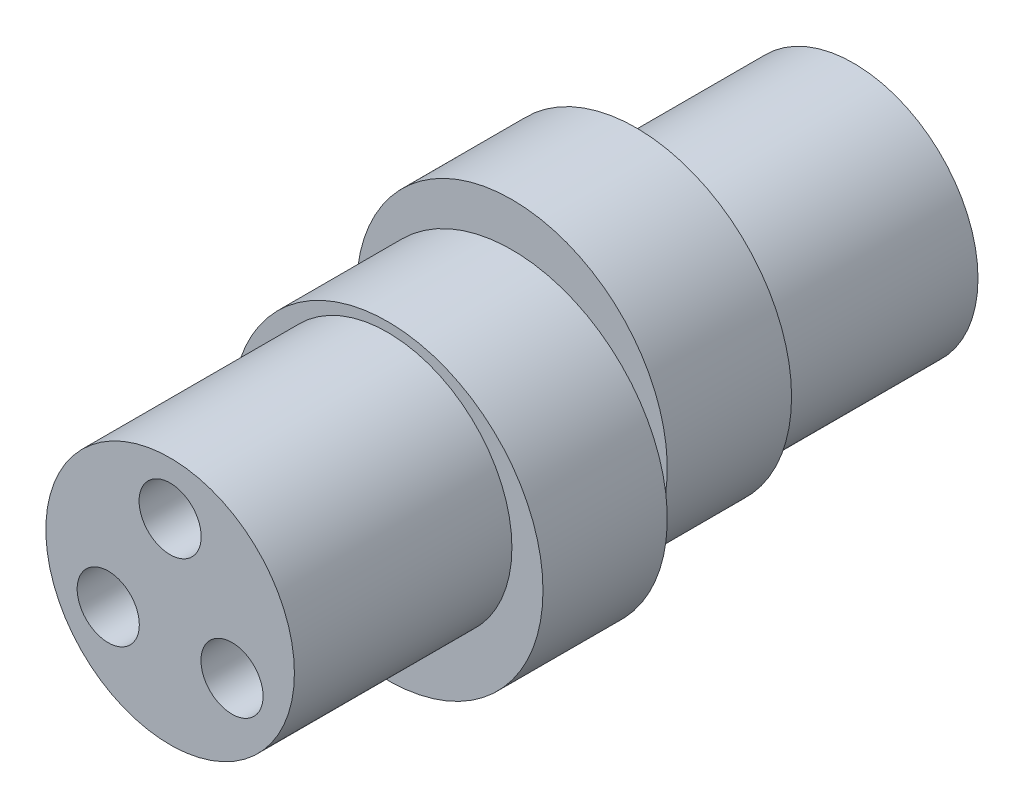
from build123d import *

# Parameters (mm, degrees)
SKETCH1_R                = 5
BOSS_EXTRUDE1_DEPTH      = 4
BOSS_EXTRUDE2_START      = 4
SKETCH2_R                = 5
BOSS_EXTRUDE2_DEPTH      = 4
BOSS_EXTRUDE5_DEPTH      = 15
BOSS_EXTRUDE5_DEPTH_BACK = 7
SKETCH5_R                = 4
CUT_EXTRUDE1_DEPTH       = 17.807438829
CUT_EXTRUDE1_DEPTH_BACK  = 17.807438829
SKETCH9_R                = 1


with BuildPart() as part:
    # Sketch1 → Boss-Extrude1 (new body)
    with BuildSketch(Plane.XY):
        with Locations((0, 0.7)):
            Circle(SKETCH1_R)
    extrude(amount=BOSS_EXTRUDE1_DEPTH)

    # Sketch2 → Boss-Extrude2 (add)
    with BuildSketch(Plane.XY.offset(BOSS_EXTRUDE2_START)):
        with Locations(Location((0, -0.7, 0), (0, 0, 171.952153753))):
            Circle(SKETCH2_R)
    extrude(amount=BOSS_EXTRUDE2_DEPTH)

    # Sketch5 → Boss-Extrude5 (add, two sides: drawn at the far end of the back side and taken through both)
    with BuildSketch(Plane.XY.offset(-BOSS_EXTRUDE5_DEPTH_BACK)):
        Circle(SKETCH5_R)
    extrude(amount=BOSS_EXTRUDE5_DEPTH + BOSS_EXTRUDE5_DEPTH_BACK)

    # Sketch9 → Cut-Extrude1 (cut, two sides: drawn at the far end of the back side and taken through both)
    with BuildSketch(Plane.XY.offset(-CUT_EXTRUDE1_DEPTH_BACK)):
        with BuildLine():
            ThreePointArc((0, 3.3), (-1, 2.3), (0, 1.3))
            Line((0, 1.3), (0, 3.3))
        make_face()
        with BuildLine():
            Line((0, 3.3), (0, 1.3))
            ThreePointArc((0, 1.3), (0.707106781, 1.592893219), (1, 2.3))
            ThreePointArc((1, 2.3), (0.707106781, 3.007106781), (0, 3.3))
        make_face()
        with Locations((-1.991858429, -1.15)):
            Circle(SKETCH9_R)
        with Locations((1.991858429, -1.15)):
            Circle(SKETCH9_R)
    extrude(amount=CUT_EXTRUDE1_DEPTH + CUT_EXTRUDE1_DEPTH_BACK, mode=Mode.SUBTRACT)


solid = part.part
